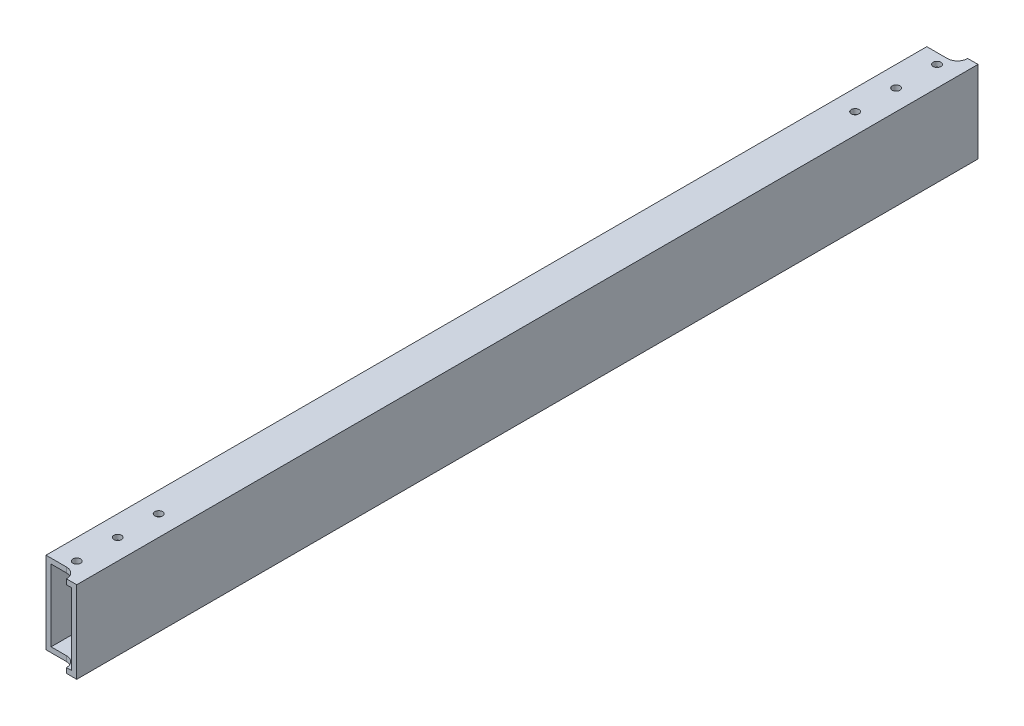
from build123d import *

# Parameters (mm, degrees)
SKETCH1_W           = 25.4
SKETCH1_H           = 50.8
BOSS_EXTRUDE1_DEPTH = 279.4
SHELL1_T            = -3.175
SKETCH3_R           = 2.38125
CUT_EXTRUDE1_DEPTH  = 285.264471927


with BuildPart() as part:
    # Sketch1 → Boss-Extrude1 (new, symmetric)
    with BuildSketch(Plane.XY):
        Rectangle(SKETCH1_W, SKETCH1_H)
    extrude(amount=BOSS_EXTRUDE1_DEPTH, both=True)

    # Shell1
    shell1_openings = [part.faces().sort_by_distance(p)[0] for p in [
        (0, 0, 279.4),
        (0, 0, -279.4),
    ]]
    offset(amount=SHELL1_T, openings=shell1_openings, kind=Kind.INTERSECTION)

    # Sketch3 → Cut-Extrude1 (cut, through all)
    with BuildSketch(Plane(origin=(0, 25.4, 0), x_dir=(1, 0, 0), z_dir=(0, 1, 0))):
        with Locations(Location((0, 266.7, 0), (0, 0, 270))):
            Circle(SKETCH3_R)
        with Locations(Location((0, 241.3, 0), (0, 0, 270))):
            Circle(SKETCH3_R)
        with Locations(Location((0, 215.9, 0), (0, 0, 270))):
            Circle(SKETCH3_R)
        with Locations(Location((0, -215.9, 0), (0, 0, 270))):
            Circle(SKETCH3_R)
        with Locations(Location((0, -241.3, 0), (0, 0, 270))):
            Circle(SKETCH3_R)
        with Locations(Location((0, -266.7, 0), (0, 0, 270))):
            Circle(SKETCH3_R)
        with BuildLine():
            Line((6.35, 279.4), (-12.7, 279.4))
            Line((-12.7, 279.4), (-12.7, 273.05))
            Line((-12.7, 273.05), (0, 273.05))
            ThreePointArc((0, 273.05), (4.490128061, 274.909871939), (6.35, 279.4))
        make_face()
        with BuildLine():
            Line((-12.7, -273.05), (0, -273.05))
            ThreePointArc((0, -273.05), (4.490128061, -274.909871939), (6.35, -279.4))
            Line((6.35, -279.4), (-12.7, -279.4))
            Line((-12.7, -279.4), (-12.7, -273.05))
        make_face()
    extrude(amount=-CUT_EXTRUDE1_DEPTH, mode=Mode.SUBTRACT)


solid = part.part
